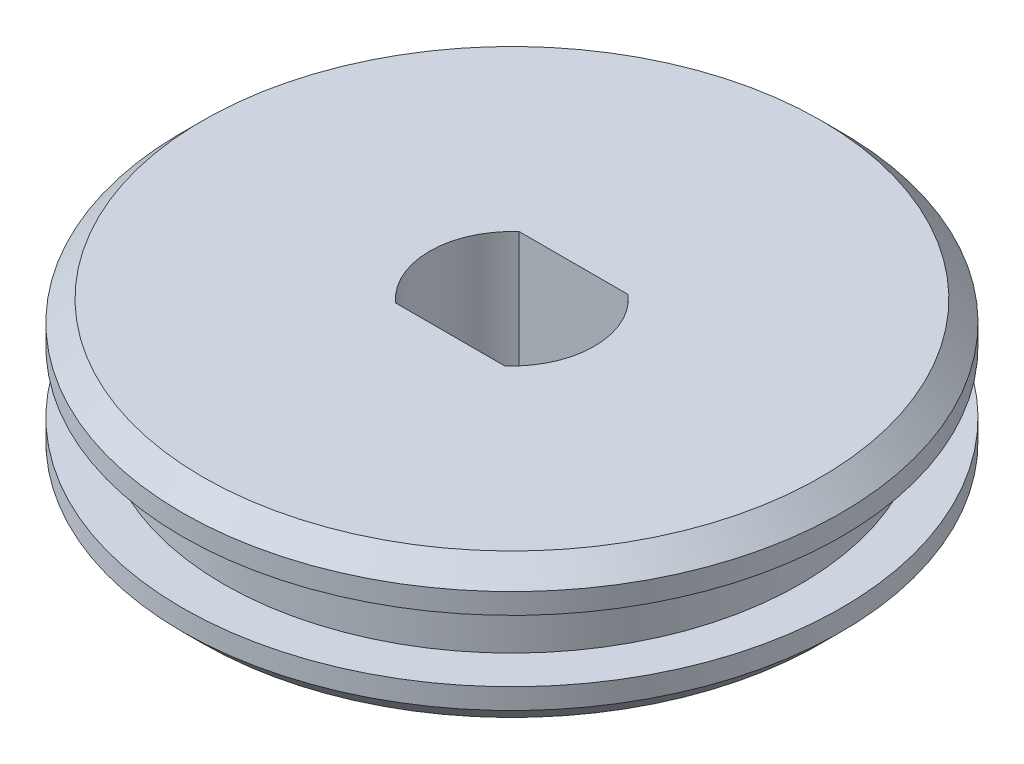
from build123d import *

# Parameters (mm, degrees)
CROQUIS1_R              = 16
SALIENTE_EXTRUIR1_DEPTH = 2
CROQUIS4_R              = 14
SALIENTE_EXTRUIR2_DEPTH = 3
CROQUIS5_R              = 16
SALIENTE_EXTRUIR3_DEPTH = 2
CORTAR_EXTRUIR1_DEPTH   = 24.685438565
CHAFL_N1_SIZE           = 1
CHAFL_N2_SIZE           = 1


with BuildPart() as part:
    # Croquis1 → Saliente-Extruir1 (new body)
    with BuildSketch(Plane(origin=(0, 0, 0), x_dir=(1, 0, 0), z_dir=(0, 1, 0))):
        with Locations(Location((0, 0, 0), (0, 0, 270))):
            Circle(CROQUIS1_R)
    extrude(amount=SALIENTE_EXTRUIR1_DEPTH)

    # Croquis4 → Saliente-Extruir2 (add)
    with BuildSketch(Plane(origin=(0, 2, 0), x_dir=(1, 0, 0), z_dir=(0, 1, 0))):
        with Locations(Location((0, 0, 0), (0, 0, 270))):
            Circle(CROQUIS4_R)
    extrude(amount=SALIENTE_EXTRUIR2_DEPTH)

    # Croquis5 → Saliente-Extruir3 (add)
    with BuildSketch(Plane(origin=(0, 5, 0), x_dir=(1, 0, 0), z_dir=(0, 1, 0))):
        with Locations(Location((0, 0, 0), (0, 0, 270))):
            Circle(CROQUIS5_R)
    extrude(amount=SALIENTE_EXTRUIR3_DEPTH)

    # Croquis6 → Cortar-Extruir1 (cut, through all)
    with BuildSketch(Plane(origin=(0, 7, 0), x_dir=(1, 0, 0), z_dir=(0, 1, 0))):
        with BuildLine():
            Line((-2.645751311, -3), (2.645751311, -3))
            ThreePointArc((2.645751311, -3), (4, 0), (2.645751311, 3))
            Line((2.645751311, 3), (-2.645751311, 3))
            ThreePointArc((-2.645751311, 3), (-4, 0), (-2.645751311, -3))
        make_face()
    extrude(amount=-CORTAR_EXTRUIR1_DEPTH, mode=Mode.SUBTRACT)

    # Chaflán1
    chafl_n1_edges = [part.edges().sort_by_distance(p)[0] for p in [
        (0, 7, -16),
    ]]
    chamfer(chafl_n1_edges, length=CHAFL_N1_SIZE)

    # Chaflán2
    chafl_n2_edges = [part.edges().sort_by_distance(p)[0] for p in [
        (0, 0, -16),
    ]]
    chamfer(chafl_n2_edges, length=CHAFL_N2_SIZE)


solid = part.part
